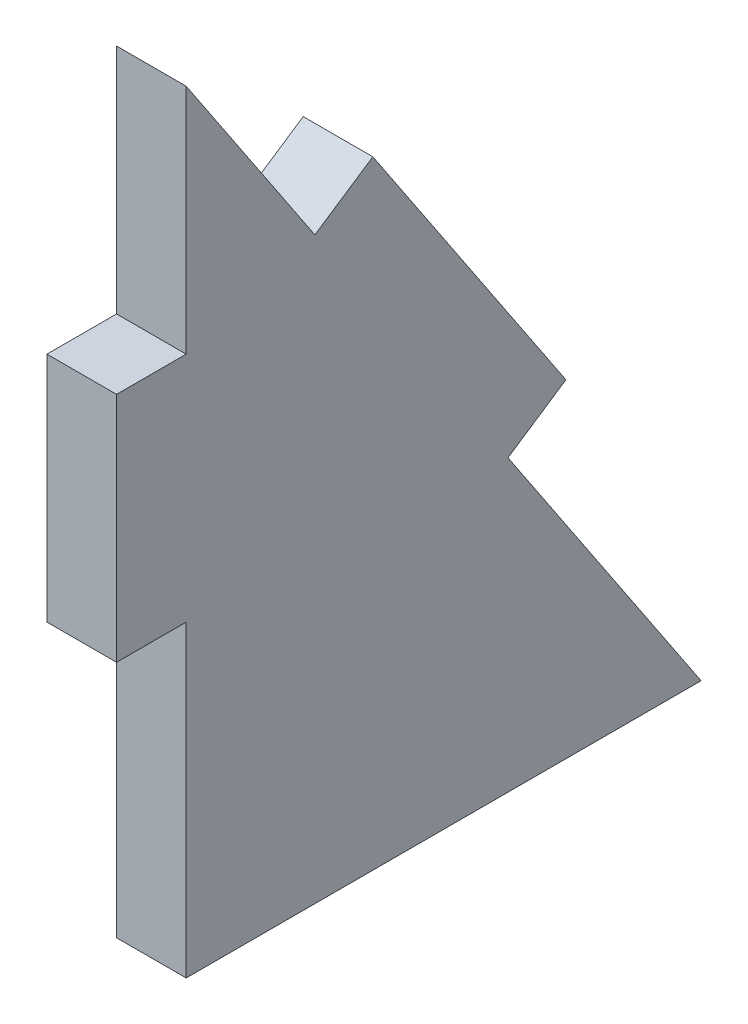
from build123d import *

# Parameters (mm, degrees)
BOSS_EXTRUDE1_DEPTH = 3


with BuildPart() as part:
    # Sketch1 → Boss-Extrude1 (new body)
    with BuildSketch(Plane(origin=(0, 0, 0), x_dir=(0, 0, -1), z_dir=(1, 0, 0))):
        Polygon((0, 33.282011772), (5.547001963, 24.961508829), (8.043152846, 26.625609418), (16.36365579, 14.144855003), (13.867504907, 12.480754414), (22.188007851, 0), (0, 0), (0, 13.282011772), (-3, 13.282011772), (-3, 23.282011772), (0, 23.282011772), align=None)
    extrude(amount=BOSS_EXTRUDE1_DEPTH)


solid = part.part
